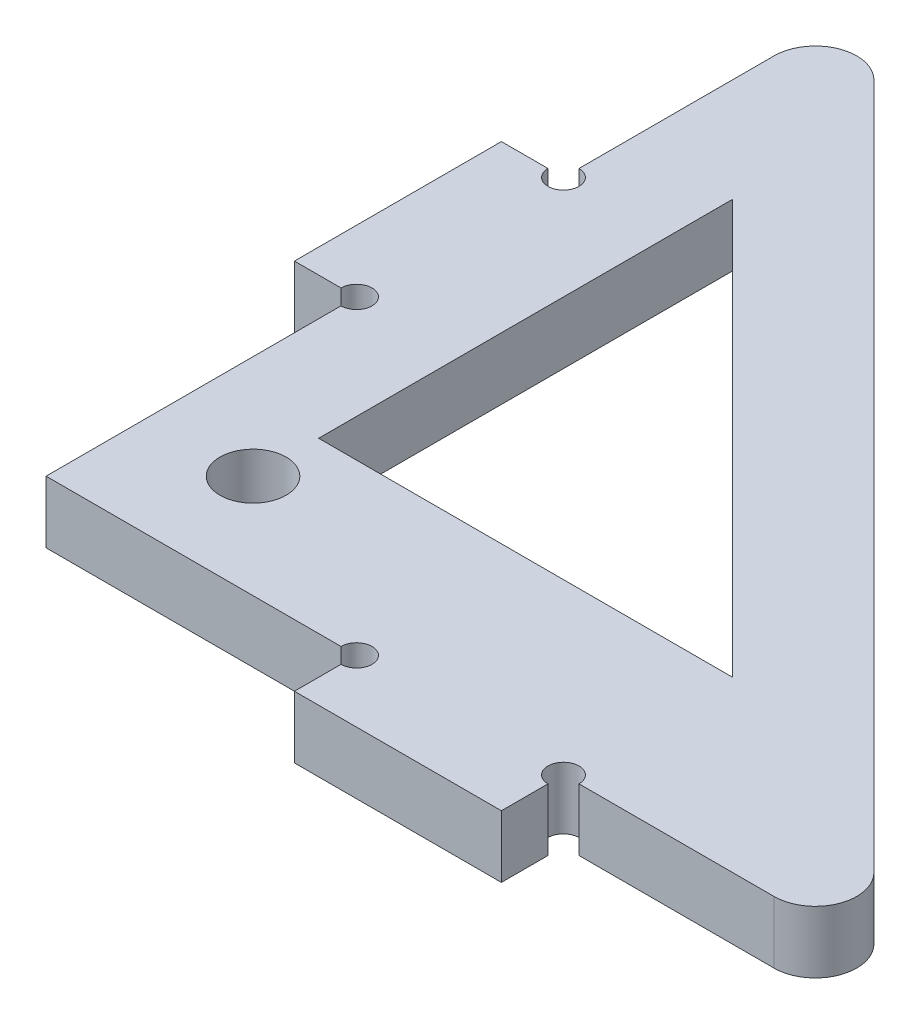
from build123d import *

# Parameters (mm, degrees)
SKETCH_1_W          = 3
SKETCH_1_H          = 10
SKETCH_1_W_2        = 10
SKETCH_1_H_2        = 3
EXTRUDE_1_DEPTH     = 3
SKETCH_2_R          = 1.6
SKETCH_2_R_2        = 0.75
CUT_EXTRUDE_1_DEPTH = 57.648036153
FILLET_1_R          = 2


with BuildPart() as part:
    # 草图1 → 凸台-拉伸1 (new body)
    with BuildSketch(Plane(origin=(0, 0, 0), x_dir=(1, 0, 0), z_dir=(0, 1, 0))):
        Polygon((40, 0), (0, 0), (0, 40), align=None)
        with Locations((-1.5, 20)):
            Rectangle(SKETCH_1_W, SKETCH_1_H)
        with Locations((20, -1.5)):
            Rectangle(SKETCH_1_W_2, SKETCH_1_H_2)
    extrude(amount=EXTRUDE_1_DEPTH)

    # 草图2 → 切除-拉伸1 (cut, through all)
    with BuildSketch(Plane(origin=(0, 3, 0), x_dir=(1, 0, 0), z_dir=(0, 1, 0))):
        with Locations(Location((5, 5, 0), (0, 0, 270))):
            Circle(SKETCH_2_R)
        with Locations((0, 25)):
            Circle(SKETCH_2_R_2)
        with Locations((0, 15)):
            Circle(SKETCH_2_R_2)
        with Locations((15, 0)):
            Circle(SKETCH_2_R_2)
        with Locations((25, 0)):
            Circle(SKETCH_2_R_2)
        Polygon((5, 28.169760455), (5, 8.169760455), (25, 8.169760455), align=None)
    extrude(amount=-CUT_EXTRUDE_1_DEPTH, mode=Mode.SUBTRACT)

    # 圆角1
    fillet_1_edges = [part.edges().sort_by_distance(p)[0] for p in [
        (0, 1.5, -40),
        (40, 1.5, 0),
    ]]
    fillet(fillet_1_edges, radius=FILLET_1_R)


solid = part.part
